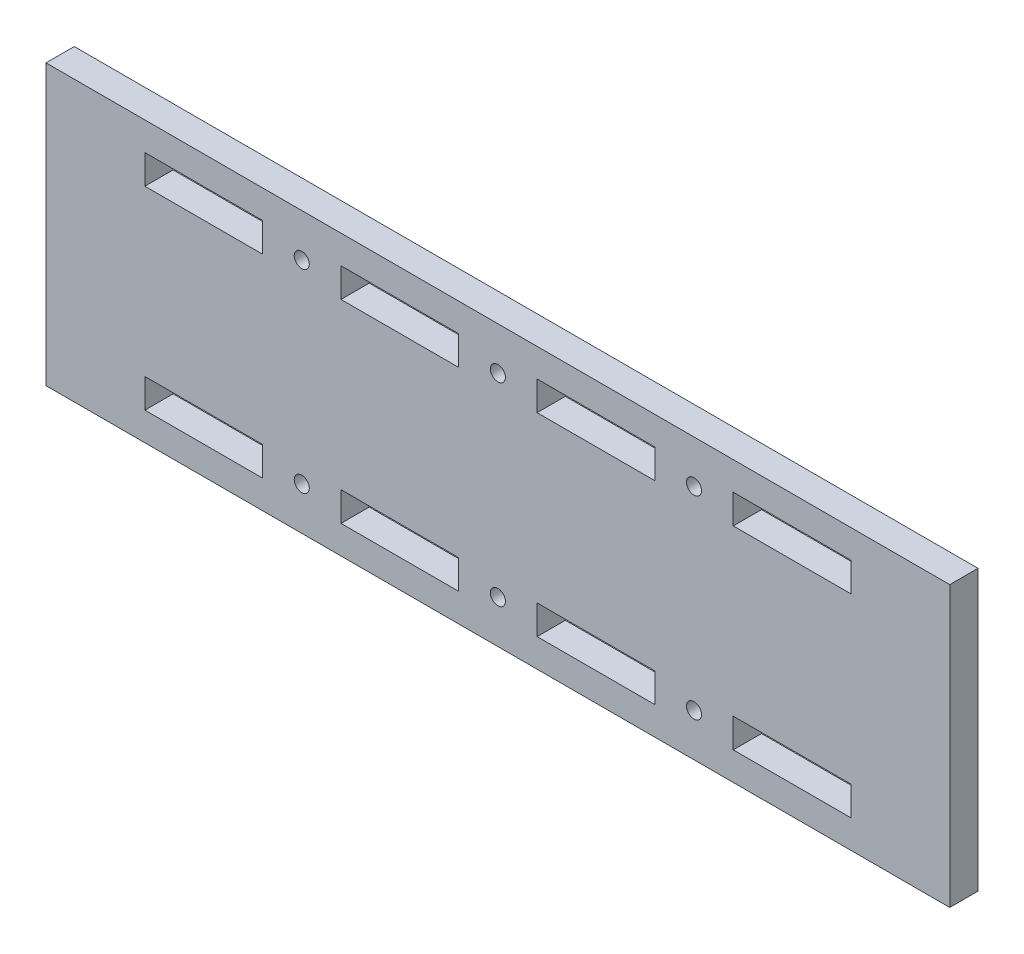
from build123d import *

# Parameters (mm, degrees)
SKETCH1_W           = 192
SKETCH1_H           = 59.4
SKETCH1_R           = 1.6
SKETCH1_W_2         = 25
SKETCH1_H_2         = 6.2
BOSS_EXTRUDE1_DEPTH = 6


with BuildPart() as part:
    # Sketch1 → Boss-Extrude1 (new body)
    with BuildSketch(Plane.XY):
        Rectangle(SKETCH1_W, SKETCH1_H)
        with Locations((-41.666666667, -20.6)):
            Circle(SKETCH1_R, mode=Mode.SUBTRACT)
        with Locations((0, -20.6)):
            Circle(SKETCH1_R, mode=Mode.SUBTRACT)
        with Locations((41.666666667, -20.6)):
            Circle(SKETCH1_R, mode=Mode.SUBTRACT)
        with Locations((0, 20.6)):
            Circle(SKETCH1_R, mode=Mode.SUBTRACT)
        with Locations((41.666666667, 20.6)):
            Circle(SKETCH1_R, mode=Mode.SUBTRACT)
        with Locations((-41.666666667, 20.6)):
            Circle(SKETCH1_R, mode=Mode.SUBTRACT)
        with Locations((-20.833333333, -20.6)):
            Rectangle(SKETCH1_W_2, SKETCH1_H_2, mode=Mode.SUBTRACT)
        with Locations((-62.5, -20.6)):
            Rectangle(SKETCH1_W_2, SKETCH1_H_2, mode=Mode.SUBTRACT)
        with Locations((20.833333333, -20.6)):
            Rectangle(SKETCH1_W_2, SKETCH1_H_2, mode=Mode.SUBTRACT)
        with Locations((62.5, -20.6)):
            Rectangle(SKETCH1_W_2, SKETCH1_H_2, mode=Mode.SUBTRACT)
        with Locations((-62.5, 20.6)):
            Rectangle(SKETCH1_W_2, SKETCH1_H_2, mode=Mode.SUBTRACT)
        with Locations((-20.833333333, 20.6)):
            Rectangle(SKETCH1_W_2, SKETCH1_H_2, mode=Mode.SUBTRACT)
        with Locations((20.833333333, 20.6)):
            Rectangle(SKETCH1_W_2, SKETCH1_H_2, mode=Mode.SUBTRACT)
        with Locations((62.5, 20.6)):
            Rectangle(SKETCH1_W_2, SKETCH1_H_2, mode=Mode.SUBTRACT)
    extrude(amount=BOSS_EXTRUDE1_DEPTH)


solid = part.part
